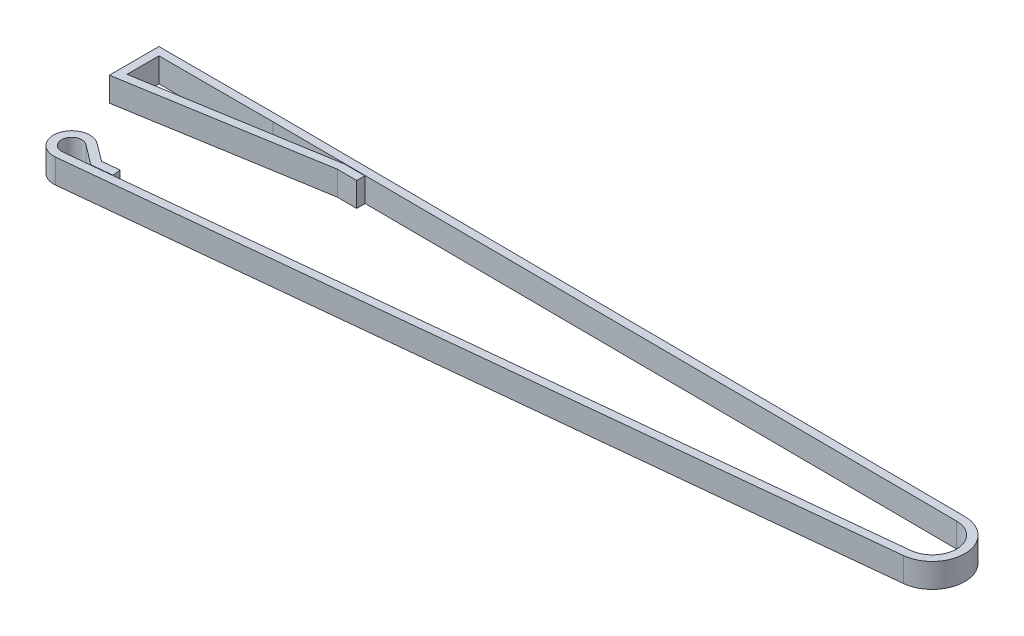
from build123d import *

# Parameters (mm, degrees)
EXTRUDE_THIN1_DEPTH = 3


with BuildPart() as part:
    # Sketch1 → Extrude-Thin1 (new, symmetric)
    with BuildSketch(Plane(origin=(0, 49.4, 0), x_dir=(1, 0, 0), z_dir=(0, 1, 0))):
        with BuildLine():
            Line((-84.551438274, -49.238070078), (-89.525331555, -49.748350033))
            Line((-89.525331555, -49.748350033), (-94.495545321, -46.003348774))
            ThreePointArc((-94.495545321, -46.003348774), (-98.408257834, -47.328960356), (-95.744860023, -50.48694664))
            Line((-95.744860023, -50.48694664), (94.507205544, -30.968671937))
            ThreePointArc((94.507205544, -30.968671937), (99.887907521, -24.711042471), (93.930134621, -19.000103636))
            Line((93.930134621, -19.000103636), (-76.224811758, -18))
            Line((-76.224811758, -18), (-104.424811758, -18))
            Line((-104.424811758, -18), (-104.424811758, -25.9))
            Line((-104.424811758, -25.9), (-58.25841835, -18.205601099))
            Line((-58.25841835, -18.205601099), (-53.25841835, -18.234989126))
            Line((-53.25841835, -18.234989126), (-53.270173358, -20.23495458))
            Line((-53.270173358, -20.23495458), (-58.098732005, -20.206574218))
            Line((-58.098732005, -20.206574218), (-106.424811758, -28.260920843))
            Line((-106.424811758, -28.260920843), (-106.424811758, -16))
            Line((-106.424811758, -16), (-76.218934203, -16))
            Line((-76.218934203, -16), (93.941889629, -17.000138181))
            ThreePointArc((93.941889629, -17.000138181), (101.885586829, -24.614723295), (94.711317525, -32.958229249))
            Line((94.711317525, -32.958229249), (-95.540748041, -52.476503953))
            ThreePointArc((-95.540748041, -52.476503953), (-100.334864102, -46.79212864), (-93.291981578, -44.406027793))
            Line((-93.291981578, -44.406027793), (-88.948638808, -47.678688669))
            Line((-88.948638808, -47.678688669), (-84.755550256, -47.248512766))
            Line((-84.755550256, -47.248512766), (-84.551438274, -49.238070078))
        make_face()
    extrude(amount=EXTRUDE_THIN1_DEPTH, both=True)


solid = part.part
